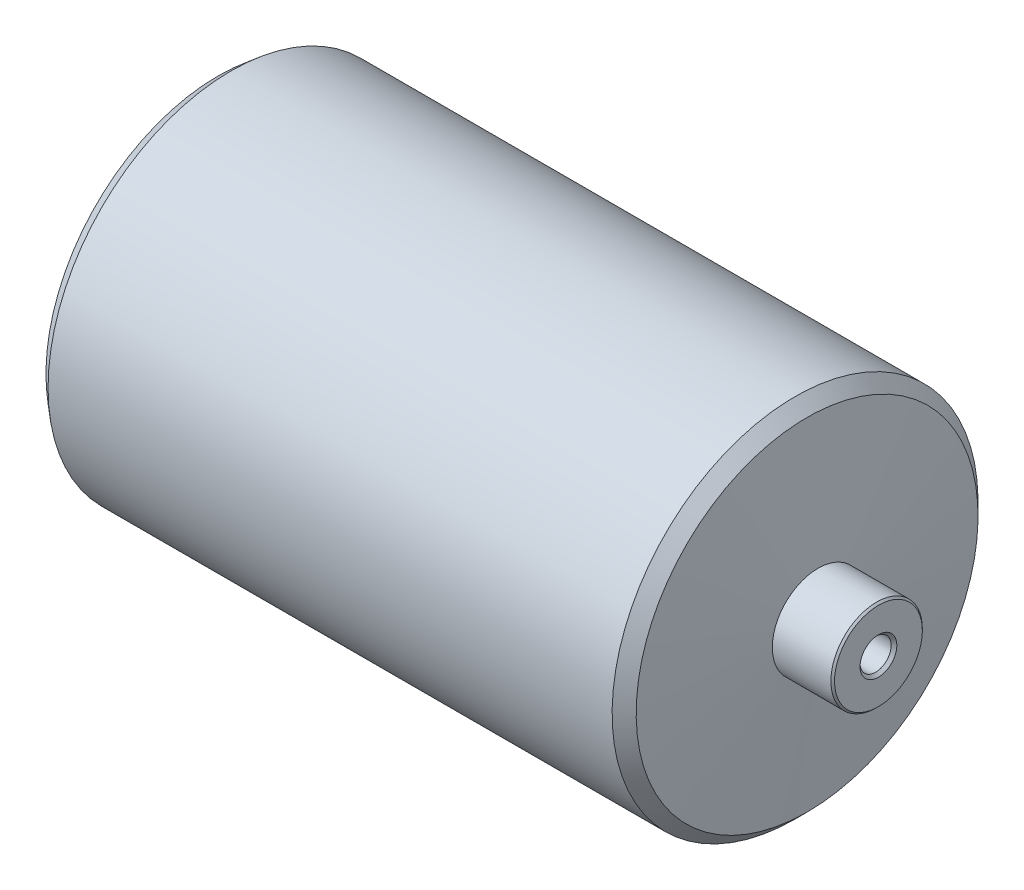
from build123d import *

# Parameters (mm, degrees)
CHAMFER1_SIZE                = 0.5
CHAMFER2_SIZE                = 3
CHAMFER2_SIZE2               = 3.300188603
CHAMFER3_SIZE                = 3
CHAMFER3_SIZE2               = 3.300188603
CHAMFER4_SIZE                = 0.5
M10_TAPPED_HOLE2_D           = 8.5
M10_TAPPED_HOLE2_DEPTH       = 56.446342369
M10_TAPPED_HOLE2_CSINK_D     = 10.05
M10_TAPPED_HOLE2_CSINK_ANGLE = 90
M10_TAPPED_HOLE2_TIP         = 2.553657631


with BuildPart() as part:
    # Sketch1 → Revolve1 (revolve)
    with BuildSketch(Plane.XY):
        Polygon((-100, 0), (-100, 12.5), (-83.5, 12.5), (-80.219175118, 50), (80.219175118, 50), (83.5, 12.5), (100, 12.5), (100, 0), align=None)
    revolve(axis=Axis((100, 0, 0), (-1, 0, 0)))

    # Chamfer1
    chamfer1_edges = [part.edges().sort_by_distance(p)[0] for p in [
        (-100, -12.5, 0),
    ]]
    chamfer(chamfer1_edges, length=CHAMFER1_SIZE)

    # Chamfer2
    chamfer2_edges = [part.edges().sort_by_distance(p)[0] for p in [
        (-80.219175118, -50, 0),
    ]]
    chamfer2_side = [part.faces().sort_by_distance(p)[0] for p in [
        (-81.859587559, -31.25, 0),
    ]]
    chamfer(chamfer2_edges, length=CHAMFER2_SIZE, length2=CHAMFER2_SIZE2, reference=chamfer2_side[0])

    # Chamfer3
    chamfer3_edges = [part.edges().sort_by_distance(p)[0] for p in [
        (80.219175118, -50, 0),
    ]]
    chamfer3_side = [part.faces().sort_by_distance(p)[0] for p in [
        (1.650094301, -50, 0),
    ]]
    chamfer(chamfer3_edges, length=CHAMFER3_SIZE, length2=CHAMFER3_SIZE2, reference=chamfer3_side[0])

    # Chamfer4
    chamfer4_edges = [part.edges().sort_by_distance(p)[0] for p in [
        (100, -12.5, 0),
    ]]
    chamfer(chamfer4_edges, length=CHAMFER4_SIZE)

    # Sketch5 → M10 Tapped Hole1 (revolve, cut)
    with BuildSketch(Plane(origin=(100, 0, 0), x_dir=(0, 0, -1), z_dir=(0, 1, 0))):
        Polygon((0, 0), (0, 59), (4.25, 56.446342369), (4.25, 0.775), (5.025, 0), align=None)
    revolve(axis=Axis((106.35, 0, 0), (-1, 0, 0)), mode=Mode.SUBTRACT)

    # M10 Tapped Hole2
    with Locations(Plane(origin=(-100, 0, 0), x_dir=(0, -1, 0), z_dir=(-1, 0, 0))):
        with Locations((0, 0)):
            CounterSinkHole(M10_TAPPED_HOLE2_D / 2, M10_TAPPED_HOLE2_CSINK_D / 2, depth=M10_TAPPED_HOLE2_DEPTH, counter_sink_angle=M10_TAPPED_HOLE2_CSINK_ANGLE)
            with Locations((0, 0, -(M10_TAPPED_HOLE2_DEPTH + M10_TAPPED_HOLE2_TIP / 2))):  # 118° drill point
                Cone(0, M10_TAPPED_HOLE2_D / 2, M10_TAPPED_HOLE2_TIP, mode=Mode.SUBTRACT)


solid = part.part
